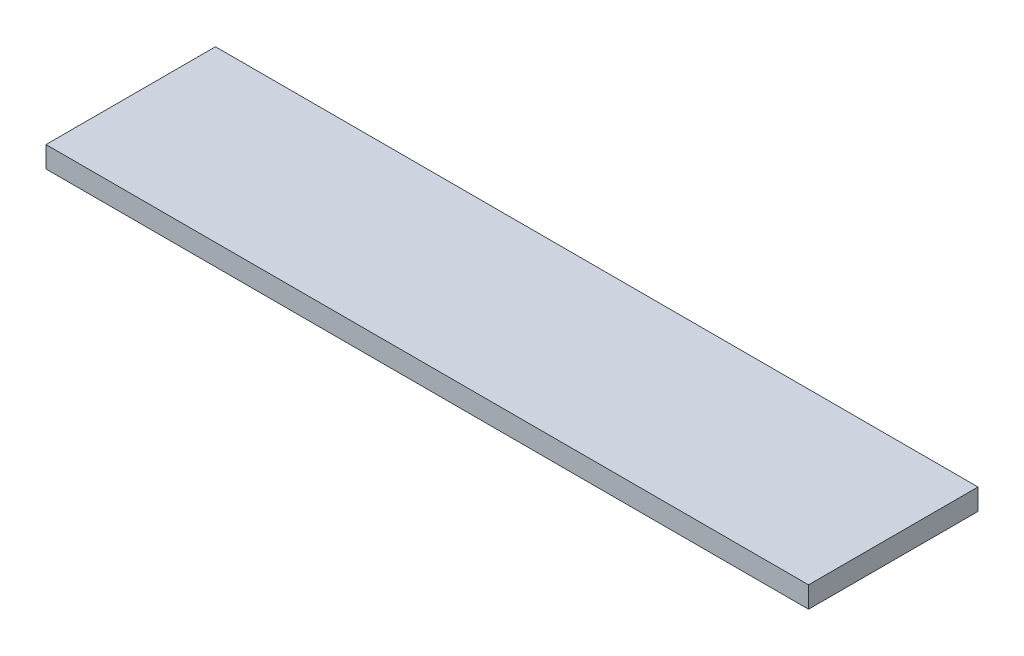
from build123d import *

# Parameters (mm, degrees)
SKETCH_1_W      = 180
SKETCH_1_H      = 40
EXTRUDE_1_DEPTH = 5


with BuildPart() as part:
    # ｽｹｯﾁ1 → ﾎﾞｽ - 押し出し1 (new body)
    with BuildSketch(Plane(origin=(0, 0, 0), x_dir=(1, 0, 0), z_dir=(0, 1, 0))):
        Rectangle(SKETCH_1_W, SKETCH_1_H)
    extrude(amount=EXTRUDE_1_DEPTH)


solid = part.part
